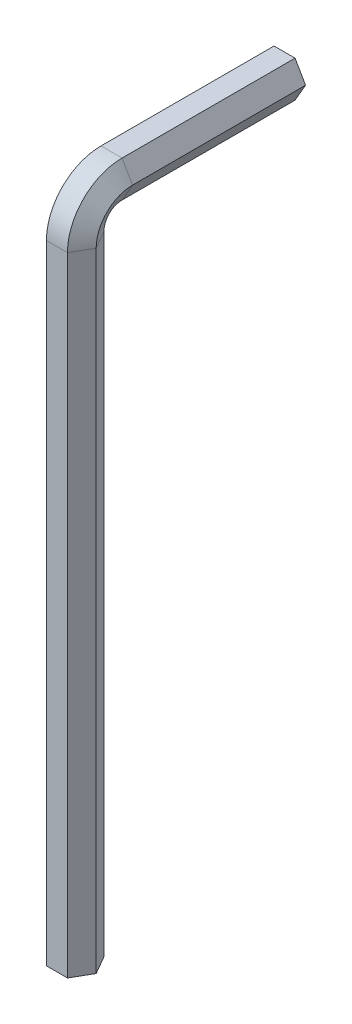
from build123d import *


with BuildPart() as part:
    # Sweep4: sweep along a path in Sketch1
    with BuildLine(Plane(origin=(0, 0, 0), x_dir=(0, 0, -1), z_dir=(1, 0, 0))) as sweep4_path:
        Line((0, 0), (0, 69))
        ThreePointArc((0, 69), (1.757359313, 73.242640687), (6, 75))
        Line((6, 75), (25, 75))
    # Sketch4 → Sweep4 (sweep)
    with BuildSketch(Plane(origin=(0, 0, -25), x_dir=(0, -1, 0), z_dir=(0, 0, 1))):
        Polygon((-75, -1.154700538), (-73, -2.309401077), (-71, -1.154700538), (-71, 1.154700538), (-73, 2.309401077), (-75, 1.154700538), align=None)
    sweep(path=sweep4_path.line)


solid = part.part
